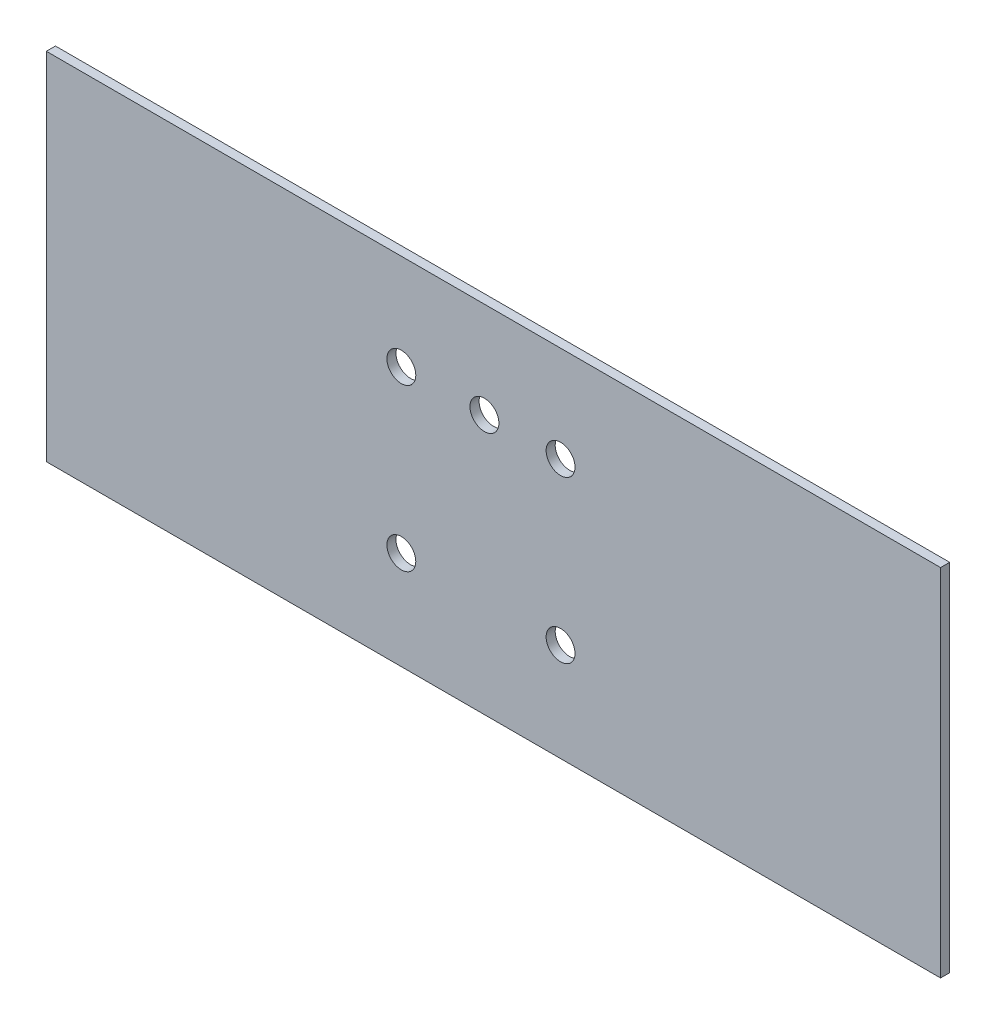
from build123d import *

# Parameters (mm, degrees)
CROQUIS1_W              = 393.13002591
CROQUIS1_H              = 156.275289803
CROQUIS1_R              = 6.35
SALIENTE_EXTRUIR1_DEPTH = 4


with BuildPart() as part:
    # Croquis1 → Saliente-Extruir1 (new body)
    with BuildSketch(Plane.XY):
        with Locations((55.494053157, -70.070785349)):
            Rectangle(CROQUIS1_W, CROQUIS1_H)
        with Locations((15, -105)):
            Circle(CROQUIS1_R, mode=Mode.SUBTRACT)
        with Locations((85, -105)):
            Circle(CROQUIS1_R, mode=Mode.SUBTRACT)
        with Locations((85, -34.089894909)):
            Circle(CROQUIS1_R, mode=Mode.SUBTRACT)
        with Locations((15, -34.089894909)):
            Circle(CROQUIS1_R, mode=Mode.SUBTRACT)
        with Locations((51.532189387, -34.089894909)):
            Circle(CROQUIS1_R, mode=Mode.SUBTRACT)
    extrude(amount=SALIENTE_EXTRUIR1_DEPTH)


solid = part.part
